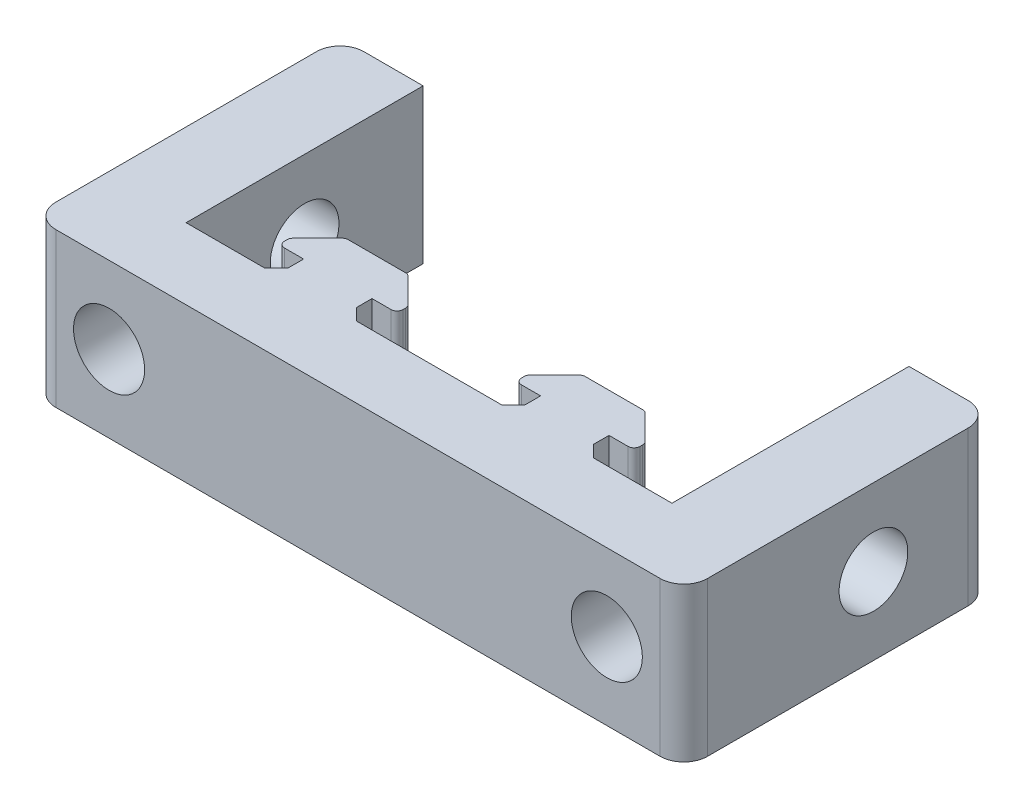
from build123d import *

# Parameters (mm, degrees)
SKETCH1_W            = 55
SKETCH1_H            = 13
BOSS_EXTRUDE1_DEPTH  = 10
SKETCH2_W            = 55
SKETCH2_H            = 13
CUT_EXTRUDE1_DEPTH   = 4
CUT_EXTRUDE2_REACH   = 30.888
SKETCH4_R            = 3
BOSS_EXTRUDE3_DEPTH  = 13
SKETCH6_W            = 7
SKETCH6_H            = 13
BOSS_EXTRUDE4_DEPTH  = 20
M5_CLEARANCE_HOLE1_D = 5.8
FILLET1_R            = 2
FILLET2_R            = 0.5


with BuildPart() as part:
    # Sketch1 → Boss-Extrude1 (new body)
    with BuildSketch(Plane.XY):
        Rectangle(SKETCH1_W, SKETCH1_H)
    extrude(amount=BOSS_EXTRUDE1_DEPTH)

    # Sketch2 → Cut-Extrude1 (cut)
    with BuildSketch(Plane.XY.offset(10)):
        Rectangle(SKETCH2_W, SKETCH2_H)
    extrude(amount=-CUT_EXTRUDE1_DEPTH, mode=Mode.SUBTRACT)

    # Sketch4 → Cut-Extrude2 (cut, up to next)
    with BuildSketch(Plane.XY.offset(6), mode=Mode.PRIVATE) as cut_extrude2_sk1:
        with Locations((21, 0)):
            Circle(SKETCH4_R)
    cut_extrude2_tool1 = extrude(cut_extrude2_sk1.sketch, amount=-CUT_EXTRUDE2_REACH, mode=Mode.PRIVATE) & part.part
    # Sketch4 → Cut-Extrude2 (cut, up to next)
    with BuildSketch(Plane.XY.offset(6), mode=Mode.PRIVATE) as cut_extrude2_sk2:
        with Locations((-21, 0)):
            Circle(SKETCH4_R)
    cut_extrude2_tool2 = extrude(cut_extrude2_sk2.sketch, amount=-CUT_EXTRUDE2_REACH, mode=Mode.PRIVATE) & part.part
    add(cut_extrude2_tool1.solids().sort_by_distance((21, 0, 6))[0], mode=Mode.SUBTRACT)
    add(cut_extrude2_tool2.solids().sort_by_distance((-21, 0, 6))[0], mode=Mode.SUBTRACT)

    # Sketch5 → Boss-Extrude3 (add)
    with BuildSketch(Plane(origin=(0, 6.5, 0), x_dir=(1, 0, 0), z_dir=(0, 1, 0))):
        Polygon((9.9, 5.5995), (12.632393219, 5.5995), (15, 3.231893219), (15, 2.3), (12.8865, 2.3), (12.8865, 0.982893219), (13.869393219, 0), (6.130606781, 0), (7.1135, 0.982893219), (7.1135, 2.3), (5, 2.3), (5, 3.231893219), (7.367606781, 5.5995), align=None)
    boss_extrude3 = extrude(amount=-BOSS_EXTRUDE3_DEPTH)

    # Mirror1: Boss-Extrude3 across plane
    add(boss_extrude3.mirror(Plane(origin=(0, 0, 0), x_dir=(0, 0, 1), z_dir=(1, 0, 0))))

    # Sketch6 → Boss-Extrude4 (add)
    with BuildSketch(Plane(origin=(0, 0, 0), x_dir=(-1, 0, 0), z_dir=(0, 0, -1))):
        with Locations((24, 0)):
            Rectangle(SKETCH6_W, SKETCH6_H)
        with Locations((-24, 0)):
            Rectangle(SKETCH6_W, SKETCH6_H)
    extrude(amount=BOSS_EXTRUDE4_DEPTH)

    # M5 Clearance Hole1 (through all)
    with Locations(Plane(origin=(-27.5, 0, -10), x_dir=(0, 0, -1), z_dir=(-1, 0, 0))):
        with Locations((0, 0)):
            Hole(M5_CLEARANCE_HOLE1_D / 2)

    # Fillet1
    fillet1_edges = [part.edges().sort_by_distance(p)[0] for p in [
        (-27.5, 0, -20),
        (27.5, 0, -20),
        (-27.5, 0, 6),
        (27.5, 0, 6),
    ]]
    fillet(fillet1_edges, radius=FILLET1_R)

    # Fillet2
    fillet2_edges = [part.edges().sort_by_distance(p)[0] for p in [
        (12.632393219, 0, -5.5995),
        (15, 0, -3.231893219),
        (15, 0, -2.3),
        (5, 0, -2.3),
        (5, 0, -3.231893219),
        (7.367606781, 0, -5.5995),
        (-15, 0, -2.3),
        (-5, 0, -2.3),
        (-5, 0, -3.231893219),
        (-7.367606781, 0, -5.5995),
        (-12.632393219, 0, -5.5995),
        (-15, 0, -3.231893219),
    ]]
    fillet(fillet2_edges, radius=FILLET2_R)


solid = part.part
